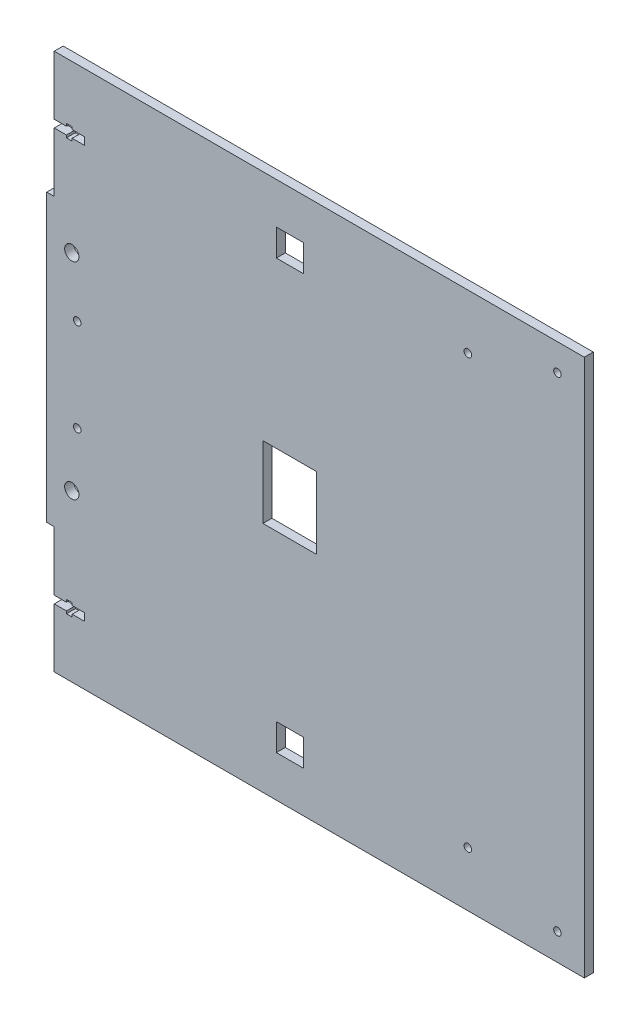
from build123d import *

# Parameters (mm, degrees)
ESQUISSE1_W              = 300
ESQUISSE1_H              = 300
BOSS_EXTRU_1_DEPTH       = 5
ESQUISSE4_W              = 5
ESQUISSE4_H              = 70.2
ENL_V_MAT_EXTRU_3_DEPTH  = 4.2
ESQUISSE7_R              = 2.1
ENL_V_MAT_EXTRU_6_DEPTH  = 213.190951739
ESQUISSE8_W              = 30
ESQUISSE8_H              = 40
ENL_V_MAT_EXTRU_7_DEPTH  = 213.190951739
ESQUISSE9_R              = 4
ENL_V_MAT_EXTRU_8_DEPTH  = 213.190951739
ESQUISSE10_R             = 2.1
ENL_V_MAT_EXTRU_9_DEPTH  = 213.190951739
ESQUISSE11_W             = 15
ESQUISSE11_H             = 15
ENL_V_MAT_EXTRU_10_DEPTH = 213.190951739
ENL_V_MAT_EXTRU_11_DEPTH = 213.190951739
ESQUISSE13_R             = 2.1
ENL_V_MAT_EXTRU_12_DEPTH = 213.190951739


with BuildPart() as part:
    # Esquisse1 → Boss.-Extru.1 (new body)
    with BuildSketch(Plane.XY):
        Rectangle(ESQUISSE1_W, ESQUISSE1_H)
    extrude(amount=BOSS_EXTRU_1_DEPTH)

    # Esquisse4 → Enlèv. mat.-Extru.3 (cut)
    with BuildSketch(Plane.ZY.offset(150)):
        with Locations((2.5, 114.9)):
            Rectangle(ESQUISSE4_W, ESQUISSE4_H)
        with Locations((2.5, -114.9)):
            Rectangle(ESQUISSE4_W, ESQUISSE4_H)
    extrude(amount=-ENL_V_MAT_EXTRU_3_DEPTH, mode=Mode.SUBTRACT)

    # Esquisse7 → Enlèv. mat.-Extru.6 (cut, through all)
    with BuildSketch(Plane.XY.offset(5)):
        with Locations((135, -135)):
            Circle(ESQUISSE7_R)
        with Locations(Location((135, 135, 0), (0, 0, 180))):
            Circle(ESQUISSE7_R)
    extrude(amount=-ENL_V_MAT_EXTRU_6_DEPTH, mode=Mode.SUBTRACT)

    # Esquisse8 → Enlèv. mat.-Extru.7 (cut, through all)
    with BuildSketch(Plane(origin=(0, 0, 0), x_dir=(-1, 0, 0), z_dir=(0, 0, -1))):
        with Locations((14.345984425, 0)):
            Rectangle(ESQUISSE8_W, ESQUISSE8_H)
    extrude(amount=-ENL_V_MAT_EXTRU_7_DEPTH, mode=Mode.SUBTRACT)

    # Esquisse9 → Enlèv. mat.-Extru.8 (cut, through all)
    with BuildSketch(Plane(origin=(0, 0, 0), x_dir=(-1, 0, 0), z_dir=(0, 0, -1))):
        with Locations((136, 57.5)):
            Circle(ESQUISSE9_R)
        with Locations(Location((136, -57.5, 0), (0, 0, 180))):
            Circle(ESQUISSE9_R)
    extrude(amount=-ENL_V_MAT_EXTRU_8_DEPTH, mode=Mode.SUBTRACT)

    # Esquisse10 → Enlèv. mat.-Extru.9 (cut, through all)
    with BuildSketch(Plane(origin=(0, 0, 0), x_dir=(-1, 0, 0), z_dir=(0, 0, -1))):
        with Locations((-85, 119.5)):
            Circle(ESQUISSE10_R)
        with Locations(Location((-85, -119.5, 0), (0, 0, 180))):
            Circle(ESQUISSE10_R)
    extrude(amount=-ENL_V_MAT_EXTRU_9_DEPTH, mode=Mode.SUBTRACT)

    # Esquisse11 → Enlèv. mat.-Extru.10 (cut, through all)
    with BuildSketch(Plane(origin=(0, 0, 0), x_dir=(-1, 0, 0), z_dir=(0, 0, -1))):
        with Locations((14.345984425, 119.5)):
            Rectangle(ESQUISSE11_W, ESQUISSE11_H)
        with Locations((14.345984425, -119.5)):
            Rectangle(ESQUISSE11_W, ESQUISSE11_H)
    extrude(amount=-ENL_V_MAT_EXTRU_10_DEPTH, mode=Mode.SUBTRACT)

    # Esquisse12 → Enlèv. mat.-Extru.11 (cut, through all)
    with BuildSketch(Plane(origin=(0, 0, 0), x_dir=(-1, 0, 0), z_dir=(0, 0, -1))):
        Polygon((145.8, -115), (145.8, -117.1), (139, -117.1), (139, -118.5), (135.8, -118.5), (135.8, -117.1), (128.8, -117.1), (128.8, -112.9), (135.8, -112.9), (135.8, -111.5), (139, -111.5), (139, -112.9), (145.8, -112.9), align=None)
        Polygon((145.8, 115), (145.8, 112.9), (139, 112.9), (139, 111.5), (135.8, 111.5), (135.8, 112.9), (128.8, 112.9), (128.8, 117.1), (135.8, 117.1), (135.8, 118.5), (139, 118.5), (139, 117.1), (145.8, 117.1), align=None)
    extrude(amount=-ENL_V_MAT_EXTRU_11_DEPTH, mode=Mode.SUBTRACT)

    # Esquisse13 → Enlèv. mat.-Extru.12 (cut, through all)
    with BuildSketch(Plane(origin=(0, 0, 0), x_dir=(-1, 0, 0), z_dir=(0, 0, -1))):
        with Locations((132.95, 25.85)):
            Circle(ESQUISSE13_R)
        with Locations(Location((132.95, -25.85, 0), (0, 0, 180))):
            Circle(ESQUISSE13_R)
    extrude(amount=-ENL_V_MAT_EXTRU_12_DEPTH, mode=Mode.SUBTRACT)


solid = part.part
